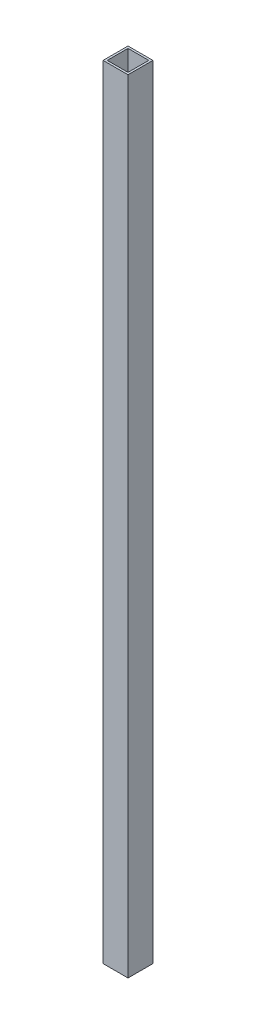
from build123d import *

# Parameters (mm, degrees)
SKETCH1_W           = 4.85
SKETCH1_H           = 4.85
SKETCH1_W_2         = 4.05
SKETCH1_H_2         = 4.05
BOSS_EXTRUDE1_DEPTH = 152.4


with BuildPart() as part:
    # Sketch1 → Boss-Extrude1 (new body)
    with BuildSketch(Plane(origin=(0, 0, 0), x_dir=(1, 0, 0), z_dir=(0, 1, 0))):
        Rectangle(SKETCH1_W, SKETCH1_H)
        Rectangle(SKETCH1_W_2, SKETCH1_H_2, mode=Mode.SUBTRACT)
    extrude(amount=BOSS_EXTRUDE1_DEPTH)


solid = part.part
